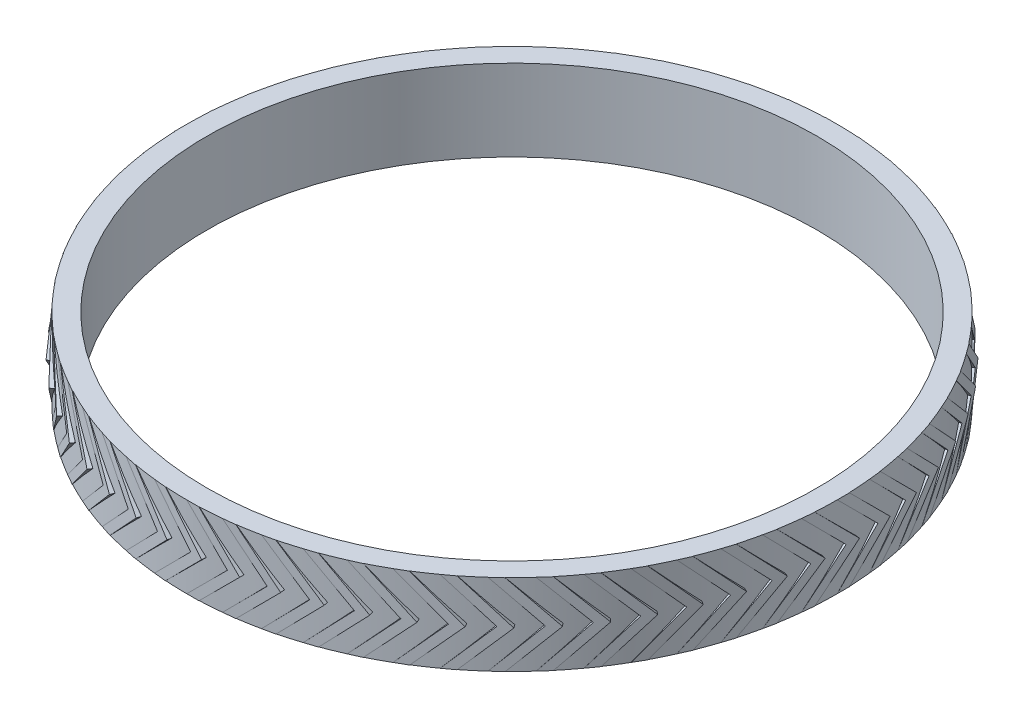
from build123d import *

# Parameters (mm, degrees)
SKETCH1_W           = 6.35
SKETCH1_H           = 25.4
BOSS_EXTRUDE1_DEPTH = 2.54
CIRPATTERN1_COUNT   = 60


with BuildPart() as part:
    # Sketch1 → Revolve1 (revolve)
    with BuildSketch(Plane(origin=(0, 0, 0), x_dir=(0, 0, -1), z_dir=(1, 0, 0)), mode=Mode.PRIVATE) as revolve1_sk:
        with Locations((-98.425, 0)):
            Rectangle(SKETCH1_W, SKETCH1_H)
    revolve(revolve1_sk.sketch.rotate(Axis((0, 0, 0), (0, 1, 0)), 180), axis=Axis((0, 0, 0), (0, 1, 0)))

    # Sketch2 → Boss-Extrude1 (add)
    with BuildSketch(Plane.ZY.offset(101.6)):
        Polygon((0, 12.7), (12.7, 0), (0, -12.7), (3.81, -12.7), (16.51, 0), (3.81, 12.7), align=None)
    boss_extrude1 = extrude(amount=-BOSS_EXTRUDE1_DEPTH)

    # CirPattern1: Boss-Extrude1 ×60 about axis
    cirpattern1_axis = Axis((0, 0, 0), (0, 1, 0))
    for i in range(1, CIRPATTERN1_COUNT):
        add(boss_extrude1.rotate(cirpattern1_axis, i * 360 / CIRPATTERN1_COUNT))


solid = part.part
